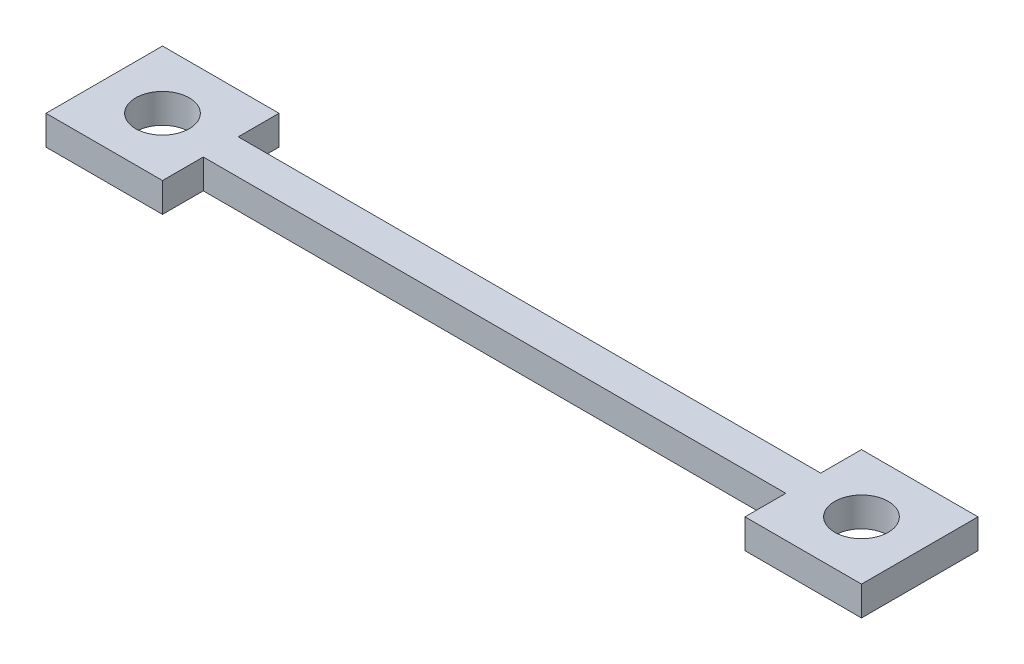
from build123d import *

# Parameters (mm, degrees)
BOSS_EXTRUDE1_DEPTH          = 0.8001
F_97_0_0059_DIAMETER_HOLE1_D = 2.921


with BuildPart() as part:
    # Sketch1 → Boss-Extrude1 (new, symmetric)
    with BuildSketch(Plane(origin=(0, 0, 0), x_dir=(1, 0, 0), z_dir=(0, 1, 0))):
        Polygon((-41.424046485, -10.283259465), (-41.424046485, -12.505759465), (-47.774046485, -12.505759465), (-47.774046485, -6.155759465), (-41.424046485, -6.155759465), (-41.424046485, -8.378259465), (-9.674046485, -8.378259465), (-9.674046485, -6.155759465), (-3.324046485, -6.155759465), (-3.324046485, -12.505759465), (-9.674046485, -12.505759465), (-9.674046485, -10.283259465), align=None)
    extrude(amount=BOSS_EXTRUDE1_DEPTH, both=True)

    # #97 (0.0059) Diameter Hole1 (through all)
    with Locations(Plane(origin=(0, 0.8001, 0), x_dir=(-1, 0, 0), z_dir=(0, 1, 0))):
        with Locations((44.599046485, 9.330759465)):
            f_97_0_0059_diameter_hole1 = Hole(F_97_0_0059_DIAMETER_HOLE1_D / 2)

    # Mirror1: #97 (0.0059) Diameter Hole1 across plane
    add(f_97_0_0059_diameter_hole1.mirror(Plane(origin=(-25.549046485, 0, 0), x_dir=(0, 0, 1), z_dir=(1, 0, 0))), mode=Mode.SUBTRACT)


solid = part.part
